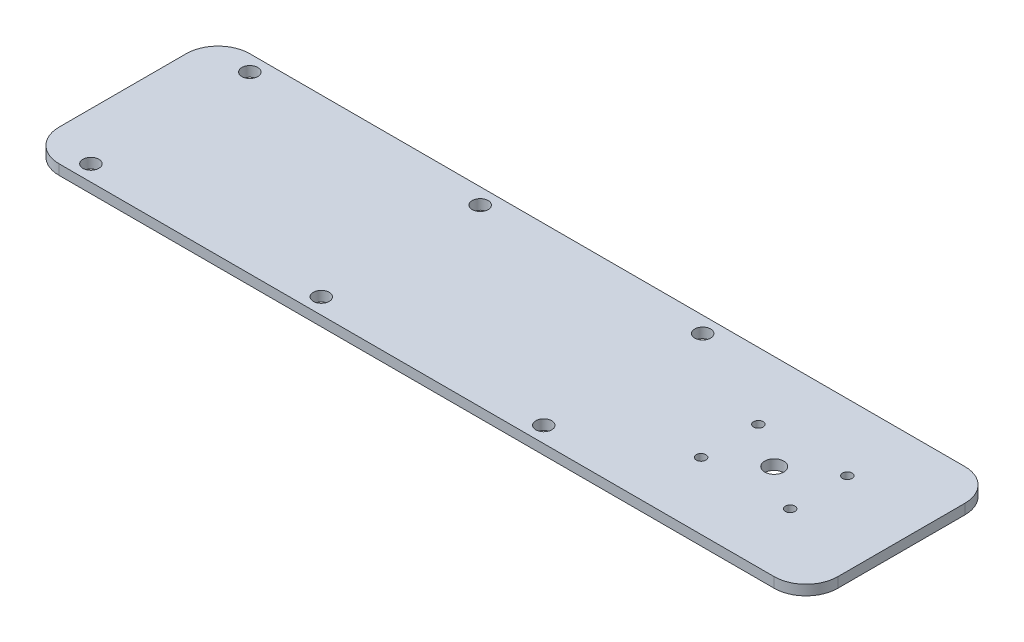
from build123d import *

# Parameters (mm, degrees)
SKETCH1_W             = 245
SKETCH1_H             = 60
BOSS_EXTRUDE1_DEPTH   = 3.175
FILLET1_R             = 10
F_6_0MM_DOWEL_HOLE1_D = 6
F_3_0MM_DOWEL_HOLE1_D = 3
F_5_0MM_DOWEL_HOLE1_D = 5


with BuildPart() as part:
    # Sketch1 → Boss-Extrude1 (new body)
    with BuildSketch(Plane(origin=(0, 0, 0), x_dir=(1, 0, 0), z_dir=(0, 1, 0))):
        with Locations((67.5, 0)):
            Rectangle(SKETCH1_W, SKETCH1_H)
    extrude(amount=BOSS_EXTRUDE1_DEPTH)

    # Fillet1
    fillet1_edges = [part.edges().sort_by_distance(p)[0] for p in [
        (-55, 1.5875, -30),
        (190, 1.5875, -30),
        (190, 1.5875, 30),
        (-55, 1.5875, 30),
    ]]
    fillet(fillet1_edges, radius=FILLET1_R)

    # Ø6.0mm Dowel Hole1 (through all)
    with Locations(Plane(origin=(0, 3.175, 0), x_dir=(1, 0, 0), z_dir=(0, 1, 0))):
        with Locations((150, 0)):
            Hole(F_6_0MM_DOWEL_HOLE1_D / 2)

    # Ø3.0mm Dowel Hole1 (through all)
    with Locations(Plane(origin=(0, 3.175, 0), x_dir=(1, 0, 0), z_dir=(0, 1, 0))):
        with Locations((164, -9), (136, -9), (136, 9), (164, 9)):
            Hole(F_3_0MM_DOWEL_HOLE1_D / 2)

    # Ø5.0mm Dowel Hole1 (through all)
    with Locations(Plane(origin=(0, 3.175, 0), x_dir=(1, 0, 0), z_dir=(0, 1, 0))):
        with Locations((32.5, -25), (102.5, -25), (102.5, 25), (32.5, 25), (-40, -25), (-40, 25)):
            Hole(F_5_0MM_DOWEL_HOLE1_D / 2)


solid = part.part
